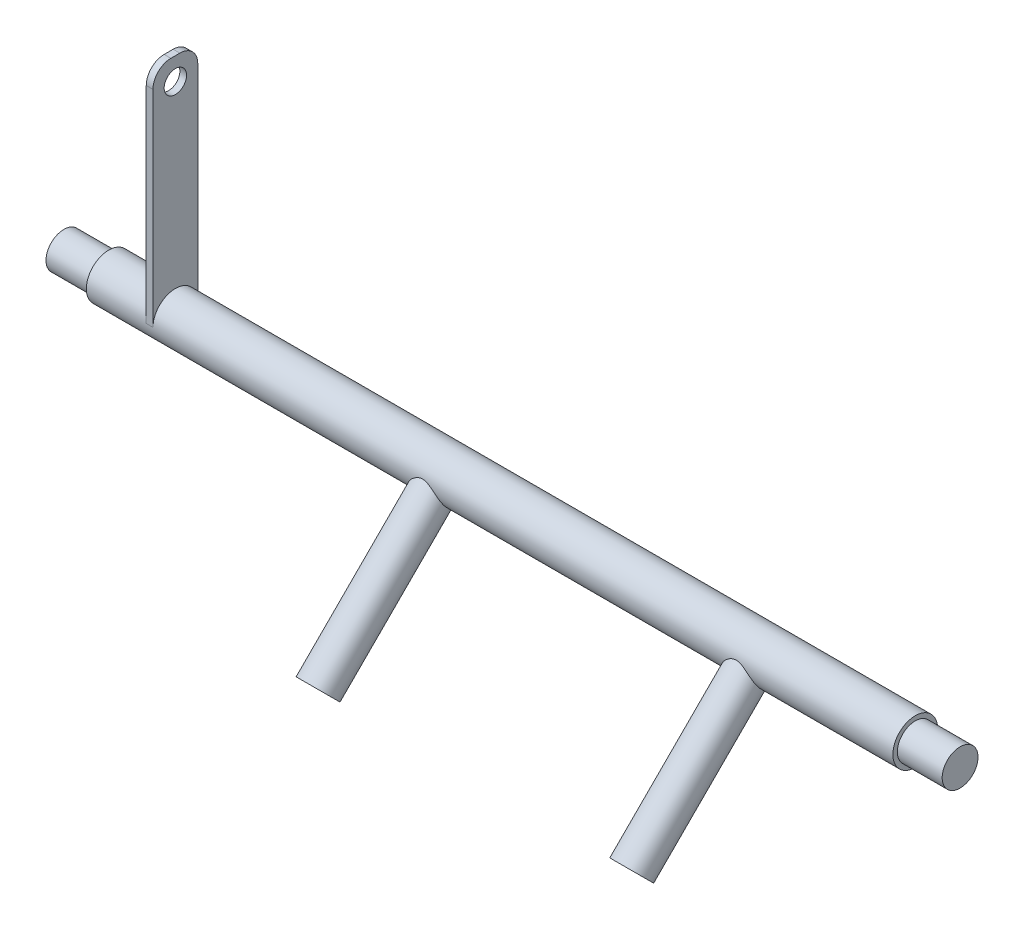
from build123d import *

# Parameters (mm, degrees)
SKETCH1_R           = 5
BOSS_EXTRUDE1_DEPTH = 200
SKETCH3_R           = 5
SKETCH3_R_2         = 4
CUT_EXTRUDE1_DEPTH  = 10
CUT_EXTRUDE2_START  = -10
SKETCH4_R           = 5
SKETCH4_R_2         = 4
CUT_EXTRUDE2_DEPTH  = 10
SKETCH5_W           = 1.5
SKETCH5_H           = 10
BOSS_EXTRUDE2_DEPTH = 50
SKETCH6_R           = 2.5
CUT_EXTRUDE3_DEPTH  = 50
FILLET1_R           = 4
SKETCH8_R           = 4
BOSS_EXTRUDE3_DEPTH = 40


with BuildPart() as part:
    # Sketch1 → Boss-Extrude1 (new body)
    with BuildSketch(Plane(origin=(0, 0, 0), x_dir=(0, 0, -1), z_dir=(1, 0, 0))):
        Circle(SKETCH1_R)
    extrude(amount=BOSS_EXTRUDE1_DEPTH)

    # Sketch3 → Cut-Extrude1 (cut)
    with BuildSketch(Plane.ZY):
        Circle(SKETCH3_R)
        Circle(SKETCH3_R_2, mode=Mode.SUBTRACT)
    extrude(amount=-CUT_EXTRUDE1_DEPTH, mode=Mode.SUBTRACT)

    # Sketch4 → Cut-Extrude2 (cut)
    with BuildSketch(Plane(origin=(200, 0, 0), x_dir=(0, 0, -1), z_dir=(1, 0, 0)).offset(CUT_EXTRUDE2_START)):
        with Locations(Location((0, 0, 0), (0, 0, 180))):
            Circle(SKETCH4_R)
        with Locations(Location((0, 0, 0), (0, 0, 180))):
            Circle(SKETCH4_R_2, mode=Mode.SUBTRACT)
    extrude(amount=CUT_EXTRUDE2_DEPTH, mode=Mode.SUBTRACT)

    # Sketch5 → Boss-Extrude2 (add)
    with BuildSketch(Plane(origin=(0, 0, 0), x_dir=(1, 0, 0), z_dir=(0, 1, 0))):
        with Locations((24.122206293, 0)):
            Rectangle(SKETCH5_W, SKETCH5_H)
    extrude(amount=BOSS_EXTRUDE2_DEPTH)

    # Sketch6 → Cut-Extrude3 (cut)
    with BuildSketch(Plane.ZY.offset(-23.372206293)):
        with Locations((0, 45)):
            Circle(SKETCH6_R)
    extrude(amount=-CUT_EXTRUDE3_DEPTH, mode=Mode.SUBTRACT)

    # Fillet1
    fillet1_edges = [part.edges().sort_by_distance(p)[0] for p in [
        (24.122206293, 50, -5),
        (24.122206293, 50, 5),
    ]]
    fillet(fillet1_edges, radius=FILLET1_R)

    # Sketch8 → Boss-Extrude3 (add)
    with BuildSketch(Plane(origin=(0, 0, 0), x_dir=(0, 0.7071067811865462, 0.7071067811865488), z_dir=(-8.296615423026079e-08, 0.7071067811865465, -0.7071067811865439))):
        with Locations((0, 155)):
            Circle(SKETCH8_R)
        with Locations((0, 85)):
            Circle(SKETCH8_R)
    extrude(amount=-BOSS_EXTRUDE3_DEPTH)


solid = part.part
